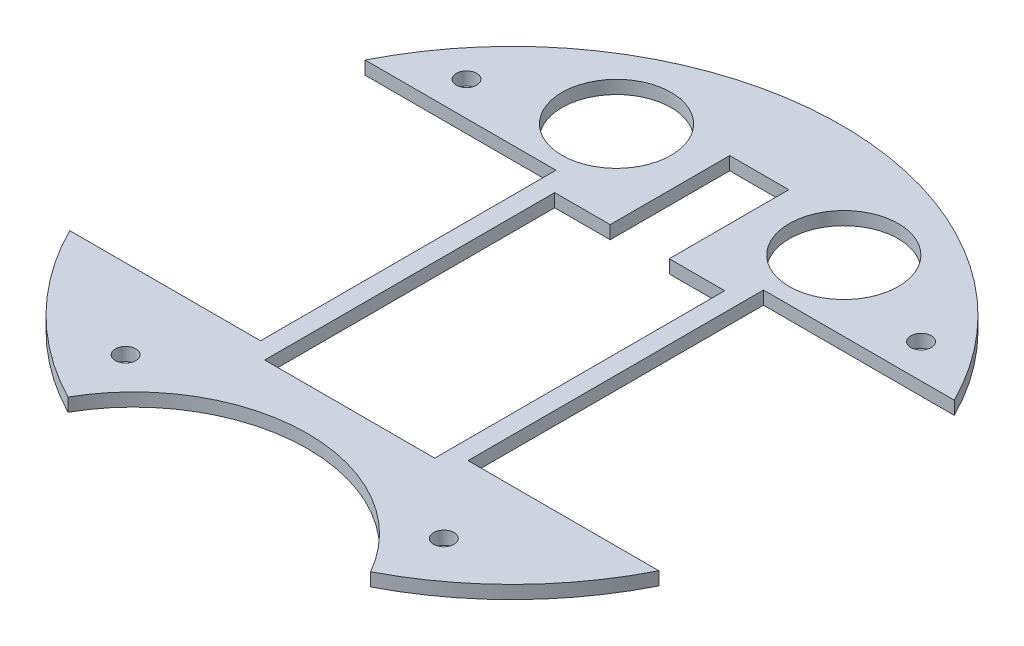
from build123d import *

# Parameters (mm, degrees)
BOSS_EXTRUDE1_DEPTH  = 2.9
SOLENOID_PLACEMENT_W = 37.4
SOLENOID_PLACEMENT_H = 63.8
CUT_EXTRUDE1_DEPTH   = 103.571487266
CUT_EXTRUDE3_DEPTH   = 103.571487266
SKETCH4_W            = 13
SKETCH4_H            = 26.3
CUT_EXTRUDE4_DEPTH   = 98.286484159
SKETCH5_R            = 12
CUT_EXTRUDE5_DEPTH   = 98.286484159
SKETCH6_R            = 2.25
CUT_EXTRUDE6_DEPTH   = 98.286484159


with BuildPart() as part:
    # Sketch1 → Boss-Extrude1 (new body)
    with BuildSketch(Plane(origin=(0, 0, 0), x_dir=(1, 0, 0), z_dir=(0, 1, 0))):
        with BuildLine():
            ThreePointArc((33.29110537, -64.404598464), (0, 72.5), (-33.29110537, -64.404598464))
            ThreePointArc((-33.29110537, -64.404598464), (0, -44.989799638), (33.29110537, -64.404598464))
        make_face()
    extrude(amount=BOSS_EXTRUDE1_DEPTH)

    # solenoid placement → Cut-Extrude1 (cut, through all)
    with BuildSketch(Plane(origin=(0, 2.9, 0), x_dir=(1, 0, 0), z_dir=(0, 1, 0))):
        with Locations((0, -3.8)):
            Rectangle(SOLENOID_PLACEMENT_W, SOLENOID_PLACEMENT_H)
    extrude(amount=-CUT_EXTRUDE1_DEPTH, mode=Mode.SUBTRACT)

    # Sketch3 → Cut-Extrude3 (cut, through all)
    with BuildSketch(Plane(origin=(0, 2.9, 0), x_dir=(1, 0, 0), z_dir=(0, 1, 0))):
        with BuildLine():
            Line((-34.63, -32.5), (-22.83, -32.5))
            Line((-22.83, -32.5), (-22.83, 32.5))
            Line((-22.83, 32.5), (-64.807406984, 32.5))
            ThreePointArc((-64.807406984, 32.5), (-72.5, 0), (-64.807406984, -32.5))
            Line((-64.807406984, -32.5), (-34.63, -32.5))
        make_face()
        with BuildLine():
            Line((34.63, -32.5), (64.807406984, -32.5))
            ThreePointArc((64.807406984, -32.5), (72.5, 0), (64.807406984, 32.5))
            Line((64.807406984, 32.5), (22.83, 32.5))
            Line((22.83, 32.5), (22.83, -32.5))
            Line((22.83, -32.5), (34.63, -32.5))
        make_face()
    extrude(amount=-CUT_EXTRUDE3_DEPTH, mode=Mode.SUBTRACT)

    # Sketch4 → Cut-Extrude4 (cut, through all)
    with BuildSketch(Plane(origin=(0, 2.9, 0), x_dir=(1, 0, 0), z_dir=(0, 1, 0))):
        with Locations((0, 41.25)):
            Rectangle(SKETCH4_W, SKETCH4_H)
    extrude(amount=-CUT_EXTRUDE4_DEPTH, mode=Mode.SUBTRACT)

    # Sketch5 → Cut-Extrude5 (cut, through all)
    with BuildSketch(Plane(origin=(0, 2.9, 0), x_dir=(1, 0, 0), z_dir=(0, 1, 0))):
        with Locations(Location((-25, 48, 0), (0, 0, 270))):
            Circle(SKETCH5_R)
        with Locations(Location((25, 48, 0), (0, 0, 270))):
            Circle(SKETCH5_R)
    extrude(amount=-CUT_EXTRUDE5_DEPTH, mode=Mode.SUBTRACT)

    # Sketch6 → Cut-Extrude6 (cut, through all)
    with BuildSketch(Plane(origin=(0, 2.9, 0), x_dir=(1, 0, 0), z_dir=(0, 1, 0))):
        with Locations(Location((35, -50, 0), (0, 0, 270))):
            Circle(SKETCH6_R)
        with Locations(Location((-35, -50, 0), (0, 0, 270))):
            Circle(SKETCH6_R)
        with Locations(Location((-50, 40, 0), (0, 0, 270))):
            Circle(SKETCH6_R)
        with Locations(Location((50, 40, 0), (0, 0, 270))):
            Circle(SKETCH6_R)
    extrude(amount=-CUT_EXTRUDE6_DEPTH, mode=Mode.SUBTRACT)


solid = part.part
